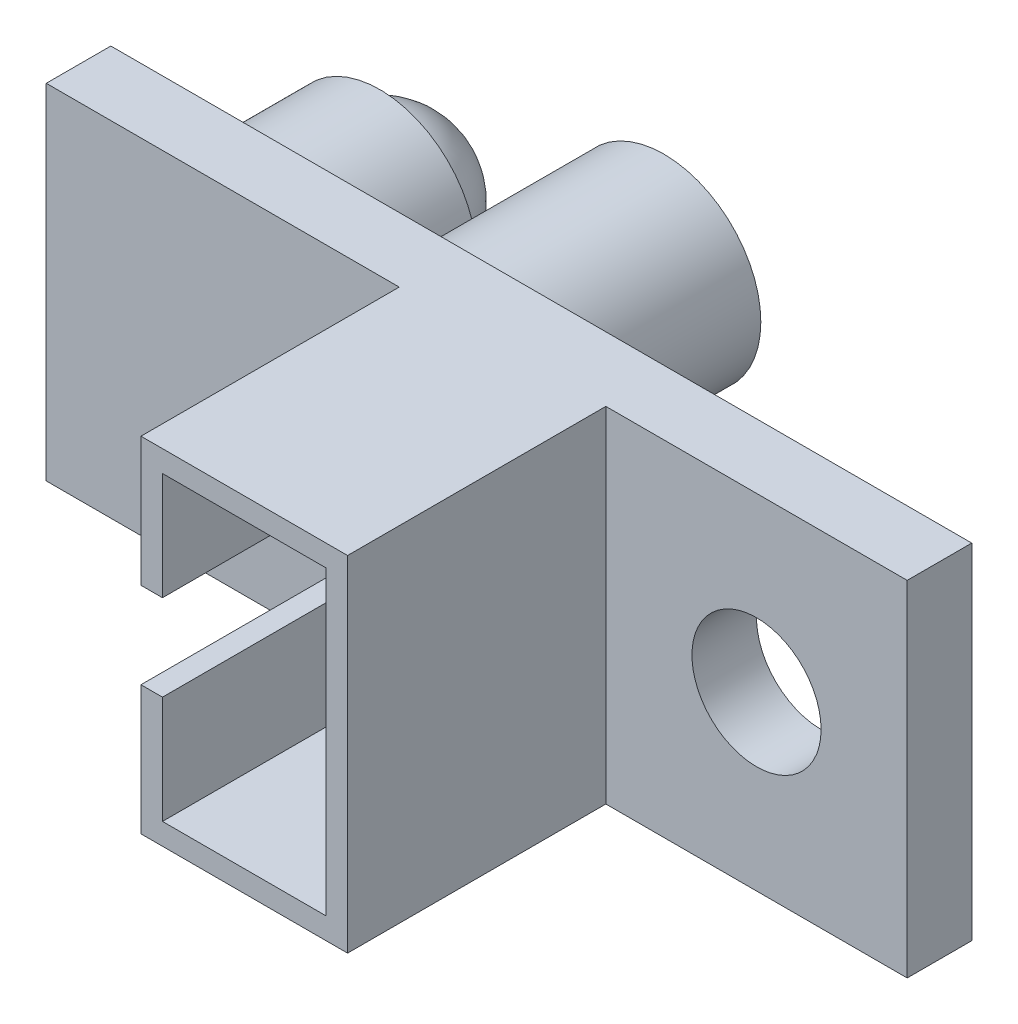
from build123d import *

# Parameters (mm, degrees)
EXTRUDE_1_DEPTH     = 1.5
SKETCH_2_R          = 1.4999999999999987
CUT_EXTRUDE_1_DEPTH = 1.5
EXTRUDE_2_DEPTH     = 6
SKETCH_4_W          = 4.500000000000001
SKETCH_4_H          = 2
CUT_EXTRUDE_4_DEPTH = 1
SKETCH_5_R          = 2.250000000000001
SKETCH_5_R_2        = 1.7500000000000016
EXTRUDE_3_DEPTH     = 4
SKETCH_8_R          = 2.250000000000001
SKETCH_8_R_2        = 1.75
EXTRUDE_13_DEPTH    = 4
SKETCH_10_R         = 2.250000000000001
SKETCH_10_R_2       = 1.7500000000000007
EXTRUDE_14_DEPTH    = 2
SKETCH_11_R         = 1.75
EXTRUDE_15_DEPTH    = 4


with BuildPart() as part:
    # 草图1 → 凸台-拉伸1 (new body)
    with BuildSketch(Plane.XY):
        Polygon((-10, 4), (10, 4), (10, -4), (-9.999999999999998, -4), align=None)
    extrude(amount=EXTRUDE_1_DEPTH)

    # 草图2 → 切除-拉伸1 (cut)
    with BuildSketch(Plane.XY.offset(1.5)):
        with Locations((6.500000000000001, 0)):
            Circle(SKETCH_2_R)
    extrude(amount=-CUT_EXTRUDE_1_DEPTH, mode=Mode.SUBTRACT)

    # 草图3 → 凸台-拉伸2 (add)
    with BuildSketch(Plane.XY.offset(1.5)):
        Polygon((-1.7999999999999998, 4), (3, 4), (3.000000000000001, -4), (-1.7999999999999987, -4), align=None)
        Polygon((-1.2999999999999996, 3.5), (2.5, 3.5), (2.5, -3.5), (-1.2999999999999987, -3.4999999999999996), align=None, mode=Mode.SUBTRACT)
    extrude(amount=EXTRUDE_2_DEPTH)

    # 草图4 → 切除-拉伸4 (cut)
    with BuildSketch(Plane.ZY.offset(1.7999999999999992)):
        with Locations((5.25, 0)):
            Rectangle(SKETCH_4_W, SKETCH_4_H)
    extrude(amount=-CUT_EXTRUDE_4_DEPTH, mode=Mode.SUBTRACT)

    # 草图5 → 凸台-拉伸3 (add)
    with BuildSketch(Plane(origin=(0, 0, 0), x_dir=(-1, 0, 0), z_dir=(0, 0, -1))):
        with Locations((7.75, 0)):
            Circle(SKETCH_5_R)
        with Locations((7.75, 0)):
            Circle(SKETCH_5_R_2, mode=Mode.SUBTRACT)
    extrude(amount=EXTRUDE_3_DEPTH)

    # 草图8 → 凸台-拉伸13 (add)
    with BuildSketch(Plane(origin=(0, 0, 0), x_dir=(-1, 0, 0), z_dir=(0, 0, -1))):
        with Locations(Location((3.15, 0, 0), (0, 0, 180))):
            Circle(SKETCH_8_R)
        with Locations((3.15, 0)):
            Circle(SKETCH_8_R_2, mode=Mode.SUBTRACT)
    extrude(amount=EXTRUDE_13_DEPTH)

    # 草图10 → 凸台-拉伸14 (add)
    with BuildSketch(Plane(origin=(0, 0, -4), x_dir=(-1, 0, 0), z_dir=(0, 0, -1))):
        with Locations(Location((3.15, 0, 0), (0, 0, 180))):
            Circle(SKETCH_10_R)
        with Locations((3.15, 0)):
            Circle(SKETCH_10_R_2, mode=Mode.SUBTRACT)
    extrude(amount=EXTRUDE_14_DEPTH)



with BuildPart() as body_2:
    # 草图6 → 旋转1 (revolve)
    with BuildSketch(Plane(origin=(0, 0, -4), x_dir=(-1, 0, 0), z_dir=(0, 0, -1))):
        with BuildLine():
            Line((7.75, 1.7500000000000018), (7.75, -1.7500000000000018))
            ThreePointArc((7.75, -1.7500000000000018), (9.500000000000002, 0), (7.75, 1.7500000000000018))
        make_face()
    revolve(axis=Axis((-7.75, 1.7500000000000018, -4), (0, -1, 0)))


with BuildPart() as body_3:
    # 草图9 → 旋转2 (revolve)
    with BuildSketch(Plane(origin=(0, 0, -4), x_dir=(-1, 0, 0), z_dir=(0, 0, -1))):
        with BuildLine():
            Line((3.15, 1.75), (3.15, -1.75))
            ThreePointArc((3.15, -1.75), (4.9, 0), (3.15, 1.75))
        make_face()
    revolve(axis=Axis((-3.15, 1.75, -4), (0, -1, 0)))


with BuildPart() as part_1:
    add(part.part)

    add(body_3.part)  # 凸台-拉伸15 merges body 3
    # 草图11 → 凸台-拉伸15 (add)
    with BuildSketch(Plane(origin=(0, 0, 0), x_dir=(-1, 0, 0), z_dir=(0, 0, -1))):
        with Locations(Location((3.15, 0, 0), (0, 0, 180))):
            Circle(SKETCH_11_R)
    extrude(amount=EXTRUDE_15_DEPTH)


solid = Compound([body_2.part, part_1.part])
